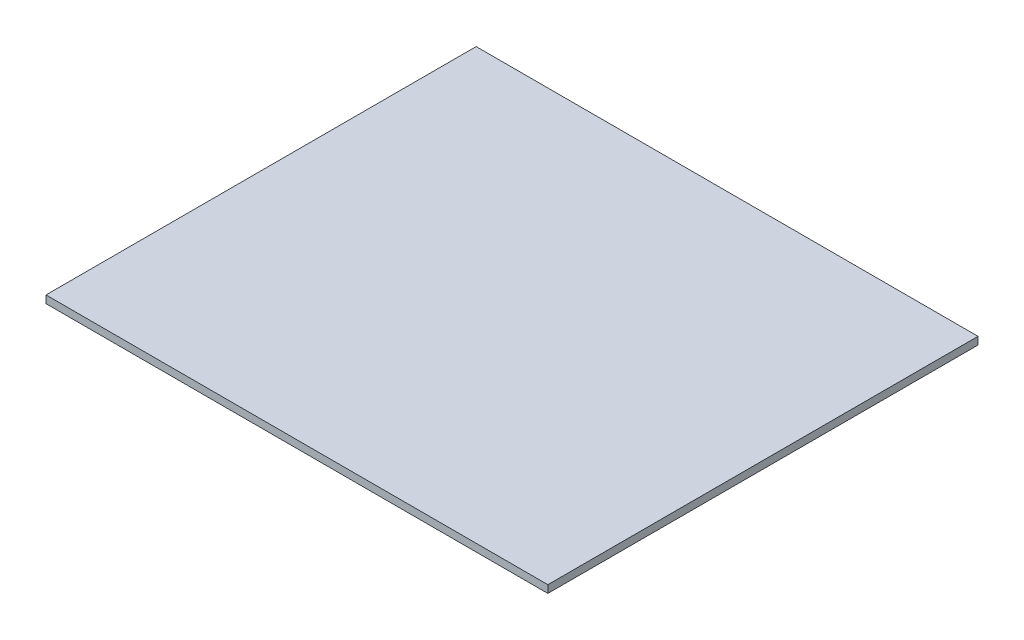
from build123d import *

# Parameters (mm, degrees)
CROQUIS1_W              = 210
CROQUIS1_H              = 180
SALIENTE_EXTRUIR1_DEPTH = 3.175


with BuildPart() as part:
    # Croquis1 → Saliente-Extruir1 (new body)
    with BuildSketch(Plane(origin=(0, 0, 0), x_dir=(1, 0, 0), z_dir=(0, 1, 0))):
        with Locations((105, 90)):
            Rectangle(CROQUIS1_W, CROQUIS1_H)
    extrude(amount=SALIENTE_EXTRUIR1_DEPTH)


solid = part.part
